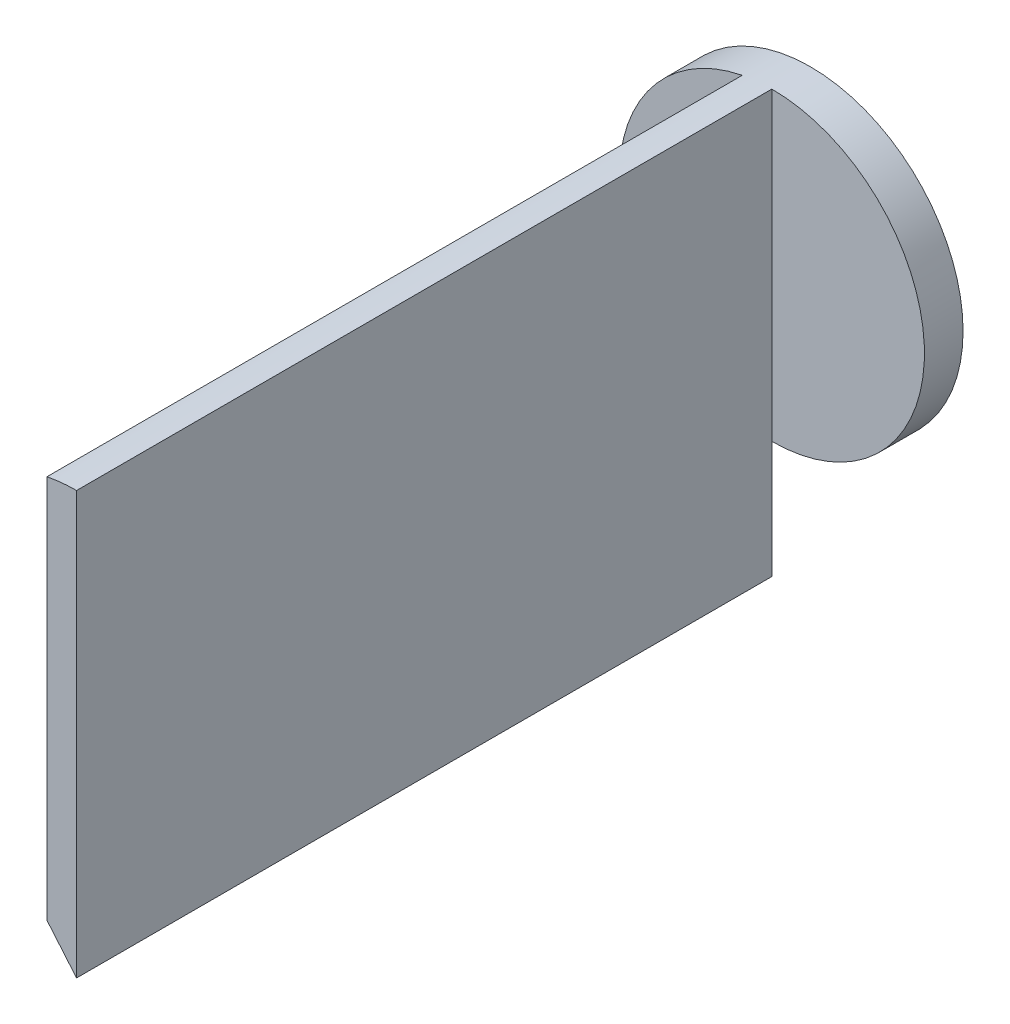
from build123d import *

# Parameters (mm, degrees)
SKETCH_1_R      = 39.499995791
EXTRUDE_1_DEPTH = 10
EXTRUDE_2_DEPTH = 180


with BuildPart() as part:
    # 草图1 → 凸台-拉伸1 (new body)
    with BuildSketch(Plane.XY):
        Circle(SKETCH_1_R)
    extrude(amount=EXTRUDE_1_DEPTH)

    # 草图2 → 凸台-拉伸2 (add)
    with BuildSketch(Plane.XY.offset(10)):
        with BuildLine():
            Line((0, -69.800050309), (0, 39.499995791))
            ThreePointArc((0, 39.499995791), (-3.851829787, 39.3117422), (-7.666944594, 38.748775827))
            Line((-7.666944594, 38.748775827), (-7.666944594, -60.694122376))
            Line((-7.666944594, -60.694122376), (0, -69.800050309))
        make_face()
    extrude(amount=EXTRUDE_2_DEPTH)


solid = part.part
